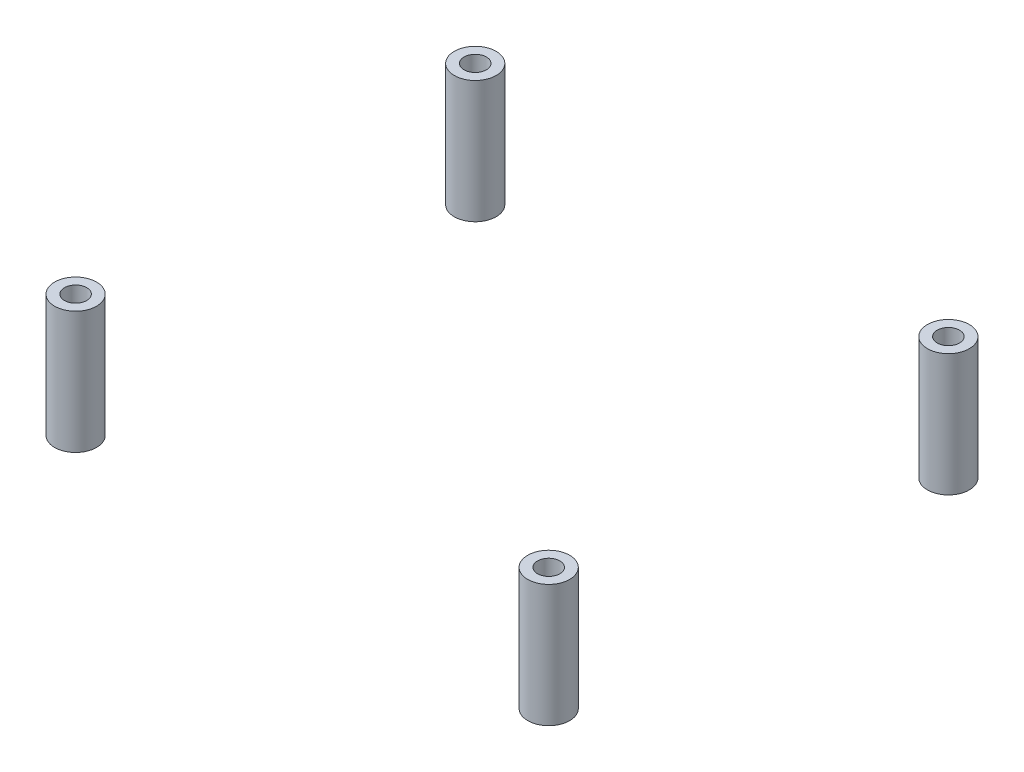
from build123d import *

# Parameters (mm, degrees)
SKETCH2_R             = 2.568182908
SKETCH2_R_2           = 1.368182908
BOSS_EXTRUDE1_DEPTH   = 15
BOSS_EXTRUDE1_2_DEPTH = 15
BOSS_EXTRUDE1_3_DEPTH = 15
BOSS_EXTRUDE1_4_DEPTH = 15


with BuildPart() as part:
    # Sketch2 → Boss-Extrude1 (new body)
    with BuildSketch(Plane(origin=(0, 0, 0), x_dir=(1, 0, 0), z_dir=(0, 1, 0))):
        with Locations(Location((186.452691975, 5.47, 0), (0, 0, 270))):
            Circle(SKETCH2_R)
        with Locations(Location((186.452691975, 5.47, 0), (0, 0, 270))):
            Circle(SKETCH2_R_2, mode=Mode.SUBTRACT)
    extrude(amount=BOSS_EXTRUDE1_DEPTH)


with BuildPart() as body_2:
    # Sketch2 → Boss-Extrude1 2 (new body)
    with BuildSketch(Plane(origin=(0, 0, 0), x_dir=(1, 0, 0), z_dir=(0, 1, 0))):
        with Locations(Location((128.455237248, 5.476812962, 0), (0, 0, 270))):
            Circle(SKETCH2_R)
        with Locations(Location((128.455237248, 5.476812962, 0), (0, 0, 270))):
            Circle(SKETCH2_R_2, mode=Mode.SUBTRACT)
    extrude(amount=BOSS_EXTRUDE1_2_DEPTH)


with BuildPart() as body_3:
    # Sketch2 → Boss-Extrude1 3 (new body)
    with BuildSketch(Plane(origin=(0, 0, 0), x_dir=(1, 0, 0), z_dir=(0, 1, 0))):
        with Locations(Location((186.452691975, 54.460262304, 0), (0, 0, 270))):
            Circle(SKETCH2_R)
        with Locations(Location((186.452691975, 54.460262304, 0), (0, 0, 270))):
            Circle(SKETCH2_R_2, mode=Mode.SUBTRACT)
    extrude(amount=BOSS_EXTRUDE1_3_DEPTH)


with BuildPart() as body_4:
    # Sketch2 → Boss-Extrude1 4 (new body)
    with BuildSketch(Plane(origin=(0, 0, 0), x_dir=(1, 0, 0), z_dir=(0, 1, 0))):
        with Locations(Location((128.455, 54.460262304, 0), (0, 0, 270))):
            Circle(SKETCH2_R)
        with Locations(Location((128.455, 54.460262304, 0), (0, 0, 270))):
            Circle(SKETCH2_R_2, mode=Mode.SUBTRACT)
    extrude(amount=BOSS_EXTRUDE1_4_DEPTH)


solid = Compound([part.part, body_2.part, body_3.part, body_4.part])
